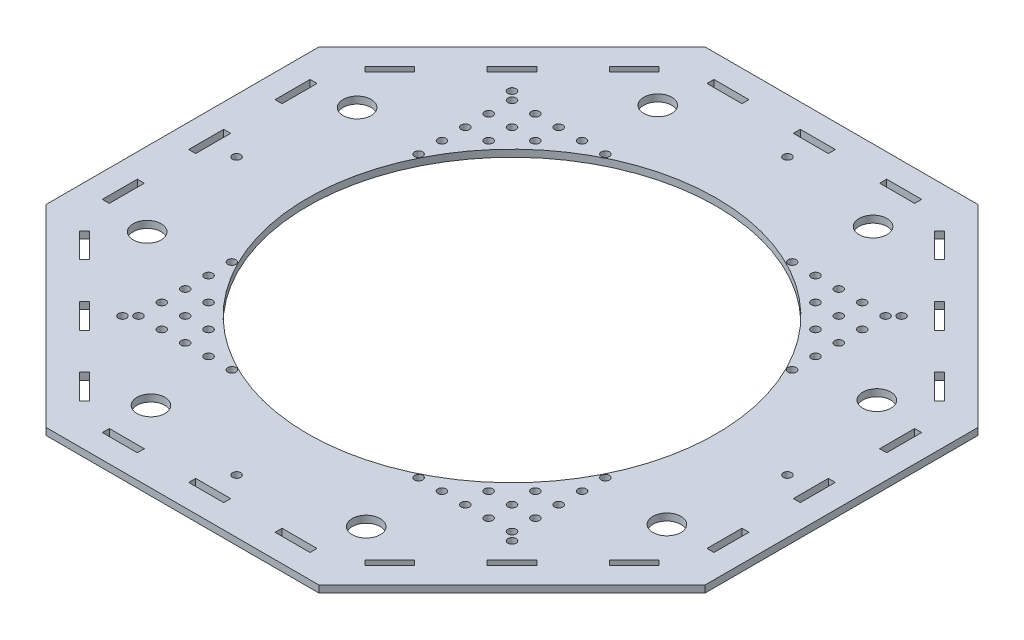
from build123d import *

# Parameters (mm, degrees)
EXTRUDE_1_DEPTH      = 1.5
EXTRUDE_1_DEPTH_BACK = 1.5
SKETCH_1_R           = 6
SKETCH_1_R_2         = 1.75
SKETCH_1_R_3         = 87.5
SKETCH_1_W           = 15
SKETCH_1_H           = 3
SKETCH_1_W_2         = 3
SKETCH_1_H_2         = 15


with BuildPart() as part:
    # Эскиз1 → Бобышка-Вытянуть1 (new, two sides: drawn at the far end of the back side and taken through both)
    with BuildSketch(Plane(origin=(0, 0, 0), x_dir=(1, 0, 0), z_dir=(0, 1, 0)).offset(-EXTRUDE_1_DEPTH_BACK)):
        Polygon((141.148979228, -58.465821511), (141.148979228, 58.465821511), (58.465821511, 141.148979228), (-58.465821511, 141.148979228), (-141.148979228, 58.465821511), (-141.148979228, -58.465821511), (-58.465821511, -141.148979228), (58.465821511, -141.148979228), align=None)
        with Locations(Location((44.154662613, 110.505048615, 0), (0, 0, 270))):
            Circle(SKETCH_1_R, mode=Mode.SUBTRACT)
        with Locations(Location((0, 118, 0), (0, 0, 270))):
            Circle(SKETCH_1_R_2, mode=Mode.SUBTRACT)
        with Locations(Location((83.43860018, 83.43860018, 0), (0, 0, 270))):
            Circle(SKETCH_1_R_2, mode=Mode.SUBTRACT)
        with Locations(Location((109.360930586, 46.916807876, 0), (0, 0, 270))):
            Circle(SKETCH_1_R, mode=Mode.SUBTRACT)
        with Locations(Location((118, 0, 0), (0, 0, 270))):
            Circle(SKETCH_1_R_2, mode=Mode.SUBTRACT)
        with Locations(Location((110.505048615, -44.154662613, 0), (0, 0, 270))):
            Circle(SKETCH_1_R, mode=Mode.SUBTRACT)
        with Locations(Location((83.43860018, -83.43860018, 0), (0, 0, 270))):
            Circle(SKETCH_1_R_2, mode=Mode.SUBTRACT)
        with Locations(Location((46.916807876, -109.360930586, 0), (0, 0, 270))):
            Circle(SKETCH_1_R, mode=Mode.SUBTRACT)
        with Locations(Location((0, -118, 0), (0, 0, 270))):
            Circle(SKETCH_1_R_2, mode=Mode.SUBTRACT)
        with Locations(Location((-44.154662613, -110.505048615, 0), (0, 0, 270))):
            Circle(SKETCH_1_R, mode=Mode.SUBTRACT)
        with Locations(Location((-83.43860018, -83.43860018, 0), (0, 0, 270))):
            Circle(SKETCH_1_R_2, mode=Mode.SUBTRACT)
        with Locations(Location((-109.360930586, -46.916807876, 0), (0, 0, 270))):
            Circle(SKETCH_1_R, mode=Mode.SUBTRACT)
        with Locations(Location((-118, 0, 0), (0, 0, 270))):
            Circle(SKETCH_1_R_2, mode=Mode.SUBTRACT)
        with Locations(Location((-110.505048615, 44.154662613, 0), (0, 0, 270))):
            Circle(SKETCH_1_R, mode=Mode.SUBTRACT)
        with Locations(Location((-83.43860018, 83.43860018, 0), (0, 0, 270))):
            Circle(SKETCH_1_R_2, mode=Mode.SUBTRACT)
        with Locations(Location((-46.916807876, 109.360930586, 0), (0, 0, 270))):
            Circle(SKETCH_1_R, mode=Mode.SUBTRACT)
        with Locations(Location((80, 40, 0), (0, 0, 270))):
            Circle(SKETCH_1_R_2, mode=Mode.SUBTRACT)
        with Locations(Location((80, 50, 0), (0, 0, 270))):
            Circle(SKETCH_1_R_2, mode=Mode.SUBTRACT)
        with Locations(Location((70, 60, 0), (0, 0, 270))):
            Circle(SKETCH_1_R_2, mode=Mode.SUBTRACT)
        with Locations(Location((80, 60, 0), (0, 0, 270))):
            Circle(SKETCH_1_R_2, mode=Mode.SUBTRACT)
        with Locations(Location((60, 70, 0), (0, 0, 270))):
            Circle(SKETCH_1_R_2, mode=Mode.SUBTRACT)
        with Locations(Location((70, 70, 0), (0, 0, 270))):
            Circle(SKETCH_1_R_2, mode=Mode.SUBTRACT)
        with Locations(Location((80, 70, 0), (0, 0, 270))):
            Circle(SKETCH_1_R_2, mode=Mode.SUBTRACT)
        with Locations(Location((40, 80, 0), (0, 0, 270))):
            Circle(SKETCH_1_R_2, mode=Mode.SUBTRACT)
        with Locations(Location((50, 80, 0), (0, 0, 270))):
            Circle(SKETCH_1_R_2, mode=Mode.SUBTRACT)
        with Locations(Location((60, 80, 0), (0, 0, 270))):
            Circle(SKETCH_1_R_2, mode=Mode.SUBTRACT)
        with Locations(Location((70, 80, 0), (0, 0, 270))):
            Circle(SKETCH_1_R_2, mode=Mode.SUBTRACT)
        with Locations(Location((80, 80, 0), (0, 0, 270))):
            Circle(SKETCH_1_R_2, mode=Mode.SUBTRACT)
        with Locations(Location((-80, 40, 0), (0, 0, 270))):
            Circle(SKETCH_1_R_2, mode=Mode.SUBTRACT)
        with Locations(Location((-80, 50, 0), (0, 0, 270))):
            Circle(SKETCH_1_R_2, mode=Mode.SUBTRACT)
        with Locations(Location((-70, 60, 0), (0, 0, 270))):
            Circle(SKETCH_1_R_2, mode=Mode.SUBTRACT)
        with Locations(Location((-80, 60, 0), (0, 0, 270))):
            Circle(SKETCH_1_R_2, mode=Mode.SUBTRACT)
        with Locations(Location((-60, 70, 0), (0, 0, 270))):
            Circle(SKETCH_1_R_2, mode=Mode.SUBTRACT)
        with Locations(Location((-70, 70, 0), (0, 0, 270))):
            Circle(SKETCH_1_R_2, mode=Mode.SUBTRACT)
        with Locations(Location((-80, 70, 0), (0, 0, 270))):
            Circle(SKETCH_1_R_2, mode=Mode.SUBTRACT)
        with Locations(Location((-40, 80, 0), (0, 0, 270))):
            Circle(SKETCH_1_R_2, mode=Mode.SUBTRACT)
        with Locations(Location((-50, 80, 0), (0, 0, 270))):
            Circle(SKETCH_1_R_2, mode=Mode.SUBTRACT)
        with Locations(Location((-60, 80, 0), (0, 0, 270))):
            Circle(SKETCH_1_R_2, mode=Mode.SUBTRACT)
        with Locations(Location((-70, 80, 0), (0, 0, 270))):
            Circle(SKETCH_1_R_2, mode=Mode.SUBTRACT)
        with Locations(Location((-80, 80, 0), (0, 0, 270))):
            Circle(SKETCH_1_R_2, mode=Mode.SUBTRACT)
        with Locations(Location((80, -40, 0), (0, 0, 270))):
            Circle(SKETCH_1_R_2, mode=Mode.SUBTRACT)
        with Locations(Location((80, -50, 0), (0, 0, 270))):
            Circle(SKETCH_1_R_2, mode=Mode.SUBTRACT)
        with Locations(Location((-70, -60, 0), (0, 0, 270))):
            Circle(SKETCH_1_R_2, mode=Mode.SUBTRACT)
        with Locations(Location((70, -60, 0), (0, 0, 270))):
            Circle(SKETCH_1_R_2, mode=Mode.SUBTRACT)
        with Locations(Location((80, -60, 0), (0, 0, 270))):
            Circle(SKETCH_1_R_2, mode=Mode.SUBTRACT)
        with Locations(Location((-70, -70, 0), (0, 0, 270))):
            Circle(SKETCH_1_R_2, mode=Mode.SUBTRACT)
        with Locations(Location((-60, -70, 0), (0, 0, 270))):
            Circle(SKETCH_1_R_2, mode=Mode.SUBTRACT)
        with Locations(Location((60, -70, 0), (0, 0, 270))):
            Circle(SKETCH_1_R_2, mode=Mode.SUBTRACT)
        with Locations(Location((70, -70, 0), (0, 0, 270))):
            Circle(SKETCH_1_R_2, mode=Mode.SUBTRACT)
        with Locations(Location((80, -70, 0), (0, 0, 270))):
            Circle(SKETCH_1_R_2, mode=Mode.SUBTRACT)
        with Locations(Location((-70, -80, 0), (0, 0, 270))):
            Circle(SKETCH_1_R_2, mode=Mode.SUBTRACT)
        with Locations(Location((-60, -80, 0), (0, 0, 270))):
            Circle(SKETCH_1_R_2, mode=Mode.SUBTRACT)
        with Locations(Location((-50, -80, 0), (0, 0, 270))):
            Circle(SKETCH_1_R_2, mode=Mode.SUBTRACT)
        with Locations(Location((-40, -80, 0), (0, 0, 270))):
            Circle(SKETCH_1_R_2, mode=Mode.SUBTRACT)
        with Locations(Location((40, -80, 0), (0, 0, 270))):
            Circle(SKETCH_1_R_2, mode=Mode.SUBTRACT)
        with Locations(Location((50, -80, 0), (0, 0, 270))):
            Circle(SKETCH_1_R_2, mode=Mode.SUBTRACT)
        with Locations(Location((60, -80, 0), (0, 0, 270))):
            Circle(SKETCH_1_R_2, mode=Mode.SUBTRACT)
        with Locations(Location((70, -80, 0), (0, 0, 270))):
            Circle(SKETCH_1_R_2, mode=Mode.SUBTRACT)
        with Locations(Location((80, -80, 0), (0, 0, 270))):
            Circle(SKETCH_1_R_2, mode=Mode.SUBTRACT)
        with Locations(Location((-80, -40, 0), (0, 0, 270))):
            Circle(SKETCH_1_R_2, mode=Mode.SUBTRACT)
        with Locations(Location((-80, -50, 0), (0, 0, 270))):
            Circle(SKETCH_1_R_2, mode=Mode.SUBTRACT)
        with Locations(Location((-80, -60, 0), (0, 0, 270))):
            Circle(SKETCH_1_R_2, mode=Mode.SUBTRACT)
        with Locations(Location((-80, -70, 0), (0, 0, 270))):
            Circle(SKETCH_1_R_2, mode=Mode.SUBTRACT)
        with Locations(Location((-80, -80, 0), (0, 0, 270))):
            Circle(SKETCH_1_R_2, mode=Mode.SUBTRACT)
        with Locations(Location((0, 0, 0), (0, 0, 270))):
            Circle(SKETCH_1_R_3, mode=Mode.SUBTRACT)
        with Locations((0, 129.5)):
            Rectangle(SKETCH_1_W, SKETCH_1_H, mode=Mode.SUBTRACT)
        with Locations((37, 129.5)):
            Rectangle(SKETCH_1_W, SKETCH_1_H, mode=Mode.SUBTRACT)
        with Locations((-37, 129.5)):
            Rectangle(SKETCH_1_W, SKETCH_1_H, mode=Mode.SUBTRACT)
        Polygon((85.206367133, 95.812968851), (95.812968851, 85.206367133), (97.934289194, 87.327687476), (87.327687476, 97.934289194), align=None, mode=Mode.SUBTRACT)
        Polygon((121.975919755, 59.043416229), (124.097240098, 61.164736573), (113.49063838, 71.771338291), (111.369318037, 69.650017947), align=None, mode=Mode.SUBTRACT)
        Polygon((59.043416229, 121.975919755), (69.650017947, 111.369318037), (71.771338291, 113.49063838), (61.164736573, 124.097240098), align=None, mode=Mode.SUBTRACT)
        with Locations((129.5, 0)):
            Rectangle(SKETCH_1_W_2, SKETCH_1_H_2, mode=Mode.SUBTRACT)
        with Locations((129.5, -37)):
            Rectangle(SKETCH_1_W_2, SKETCH_1_H_2, mode=Mode.SUBTRACT)
        with Locations((129.5, 37)):
            Rectangle(SKETCH_1_W_2, SKETCH_1_H_2, mode=Mode.SUBTRACT)
        Polygon((95.812968851, -85.206367133), (85.206367133, -95.812968851), (87.327687476, -97.934289194), (97.934289194, -87.327687476), align=None, mode=Mode.SUBTRACT)
        Polygon((59.043416229, -121.975919755), (61.164736573, -124.097240098), (71.771338291, -113.49063838), (69.650017947, -111.369318037), align=None, mode=Mode.SUBTRACT)
        Polygon((121.975919755, -59.043416229), (111.369318037, -69.650017947), (113.49063838, -71.771338291), (124.097240098, -61.164736573), align=None, mode=Mode.SUBTRACT)
        with Locations((0, -129.5)):
            Rectangle(SKETCH_1_W, SKETCH_1_H, mode=Mode.SUBTRACT)
        with Locations((-37, -129.5)):
            Rectangle(SKETCH_1_W, SKETCH_1_H, mode=Mode.SUBTRACT)
        with Locations((37, -129.5)):
            Rectangle(SKETCH_1_W, SKETCH_1_H, mode=Mode.SUBTRACT)
        Polygon((-85.206367133, -95.812968851), (-95.812968851, -85.206367133), (-97.934289194, -87.327687476), (-87.327687476, -97.934289194), align=None, mode=Mode.SUBTRACT)
        Polygon((-121.975919755, -59.043416229), (-124.097240098, -61.164736573), (-113.49063838, -71.771338291), (-111.369318037, -69.650017947), align=None, mode=Mode.SUBTRACT)
        Polygon((-59.043416229, -121.975919755), (-69.650017947, -111.369318037), (-71.771338291, -113.49063838), (-61.164736573, -124.097240098), align=None, mode=Mode.SUBTRACT)
        with Locations((-129.5, 0)):
            Rectangle(SKETCH_1_W_2, SKETCH_1_H_2, mode=Mode.SUBTRACT)
        with Locations((-129.5, 37)):
            Rectangle(SKETCH_1_W_2, SKETCH_1_H_2, mode=Mode.SUBTRACT)
        with Locations((-129.5, -37)):
            Rectangle(SKETCH_1_W_2, SKETCH_1_H_2, mode=Mode.SUBTRACT)
        Polygon((-95.812968851, 85.206367133), (-85.206367133, 95.812968851), (-87.327687476, 97.934289194), (-97.934289194, 87.327687476), align=None, mode=Mode.SUBTRACT)
        Polygon((-59.043416229, 121.975919755), (-61.164736573, 124.097240098), (-71.771338291, 113.49063838), (-69.650017947, 111.369318037), align=None, mode=Mode.SUBTRACT)
        Polygon((-121.975919755, 59.043416229), (-111.369318037, 69.650017947), (-113.49063838, 71.771338291), (-124.097240098, 61.164736573), align=None, mode=Mode.SUBTRACT)
    extrude(amount=EXTRUDE_1_DEPTH + EXTRUDE_1_DEPTH_BACK)


solid = part.part
